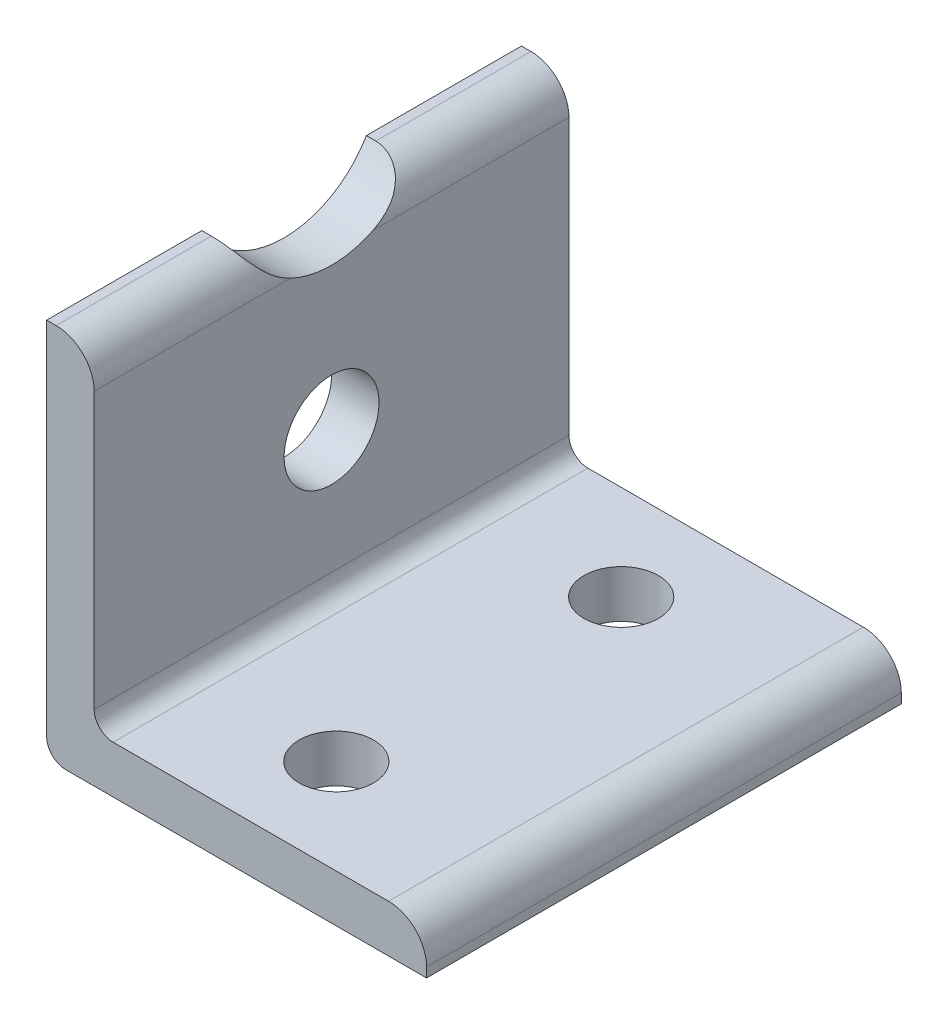
from build123d import *

# Parameters (mm, degrees)
BOSS_EXTRUDE1_DEPTH = 31.75
FILLET1_R           = 2.54
FILLET2_R           = 1.27
SKETCH2_R           = 6.35
CUT_EXTRUDE1_DEPTH  = 48.941448664
SKETCH3_R           = 2.4892
CUT_EXTRUDE2_DEPTH  = 47.33759959
SKETCH4_R           = 3.175
CUT_EXTRUDE3_DEPTH  = 47.337599597


with BuildPart() as part:
    # Sketch1 → Boss-Extrude1 (new body)
    with BuildSketch(Plane.XY):
        Polygon((0, 0), (0, 25.4), (3.175, 25.4), (3.175, 3.175), (25.4, 3.175), (25.4, 0), align=None)
    extrude(amount=BOSS_EXTRUDE1_DEPTH)

    # Fillet1
    fillet1_edges = [part.edges().sort_by_distance(p)[0] for p in [
        (3.175, 25.4, 15.875),
        (25.4, 3.175, 15.875),
    ]]
    fillet(fillet1_edges, radius=FILLET1_R)

    # Fillet2
    fillet2_edges = [part.edges().sort_by_distance(p)[0] for p in [
        (0, 0, 15.875),
        (3.175, 3.175, 15.875),
    ]]
    fillet(fillet2_edges, radius=FILLET2_R)

    # Sketch2 → Cut-Extrude1 (cut, through all)
    with BuildSketch(Plane.ZY):
        with Locations((15.875, 28.575)):
            Circle(SKETCH2_R)
    extrude(amount=-CUT_EXTRUDE1_DEPTH, mode=Mode.SUBTRACT)

    # Sketch3 → Cut-Extrude2 (cut, through all)
    with BuildSketch(Plane(origin=(0, 3.175, 0), x_dir=(1, 0, 0), z_dir=(0, 1, 0))):
        with Locations(Location((13.0175, -6.35, 0), (0, 0, 270))):
            Circle(SKETCH3_R)
        with Locations(Location((13.0175, -25.4, 0), (0, 0, 270))):
            Circle(SKETCH3_R)
    extrude(amount=-CUT_EXTRUDE2_DEPTH, mode=Mode.SUBTRACT)

    # Sketch4 → Cut-Extrude3 (cut, through all)
    with BuildSketch(Plane(origin=(3.175, 0, 0), x_dir=(0, 0, -1), z_dir=(1, 0, 0))):
        with Locations(Location((-15.875, 12.7, 0), (0, 0, 90))):
            Circle(SKETCH4_R)
    extrude(amount=-CUT_EXTRUDE3_DEPTH, mode=Mode.SUBTRACT)


solid = part.part
